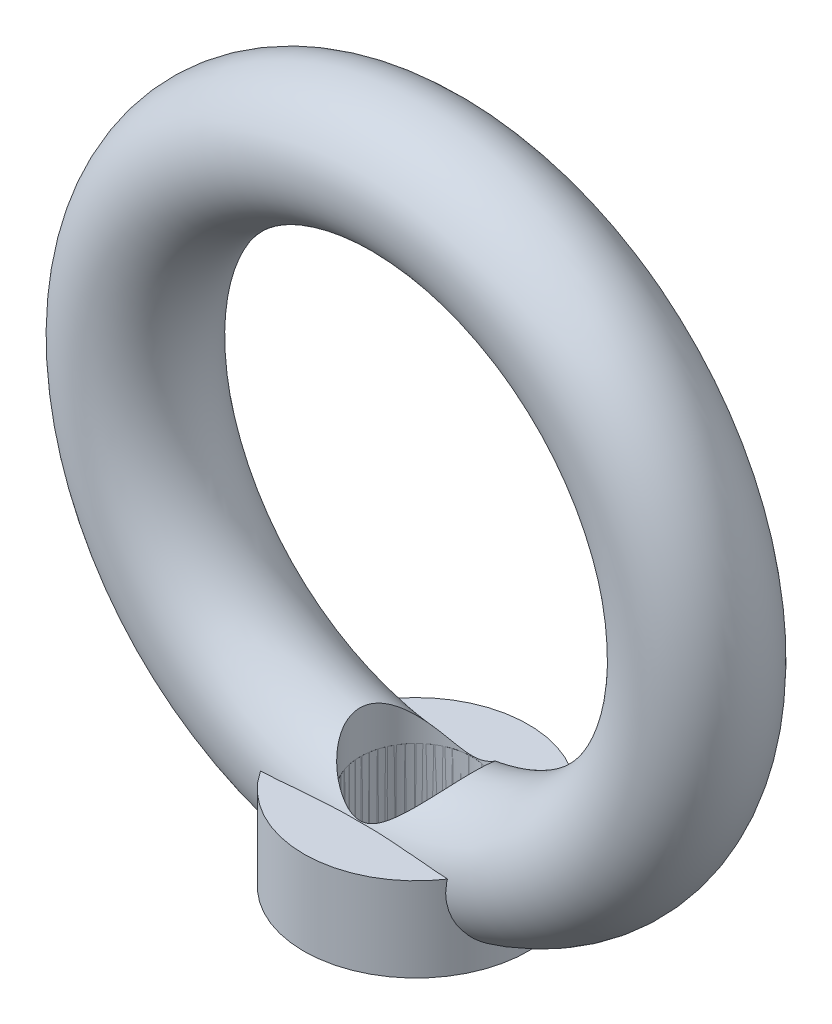
from build123d import *
from build123d.topology import SkipClean

# Parameters (mm, degrees)
SKETCH_2_R               = 2.25
SKETCH_3_R               = 4
SKETCH_3_R_2             = 2
EXTRUDE_1_DEPTH          = 3
CUT_EXTRUDE_5_DEPTH      = 13
CUT_EXTRUDE_5_DEPTH_BACK = 3
SKETCH_3_5_R             = 2


with BuildPart() as part:
    # 草图2 → 旋转1 (revolve)
    with BuildSketch(Plane(origin=(0, 0, 0), x_dir=(1, 0, 0), z_dir=(0, 1, 0))):
        with Locations((10, 0)):
            Circle(SKETCH_2_R)
    revolve(axis=Axis((0, 0, -2.2), (0, 0, 1)))

    # 草图3<5> → 切除-拉伸5 (cut, two sides: drawn at the far end of the back side and taken through both)
    with SkipClean():  # the faces are left unmerged after this step: merging them gives an invalid solid
        with BuildSketch(Plane(origin=(0, -12, 0), x_dir=(1, 0, 0), z_dir=(0, 1, 0)).offset(-CUT_EXTRUDE_5_DEPTH_BACK)):
            Circle(SKETCH_3_5_R)
        extrude(amount=CUT_EXTRUDE_5_DEPTH + CUT_EXTRUDE_5_DEPTH_BACK, mode=Mode.SUBTRACT)


with BuildPart() as body_2:
    # 草图3 → 凸台-拉伸1 (new body)
    with BuildSketch(Plane(origin=(0, -12, 0), x_dir=(1, 0, 0), z_dir=(0, 1, 0))):
        Circle(SKETCH_3_R)
        Circle(SKETCH_3_R_2, mode=Mode.SUBTRACT)
    extrude(amount=EXTRUDE_1_DEPTH)


solid = Compound([part.part, body_2.part])
